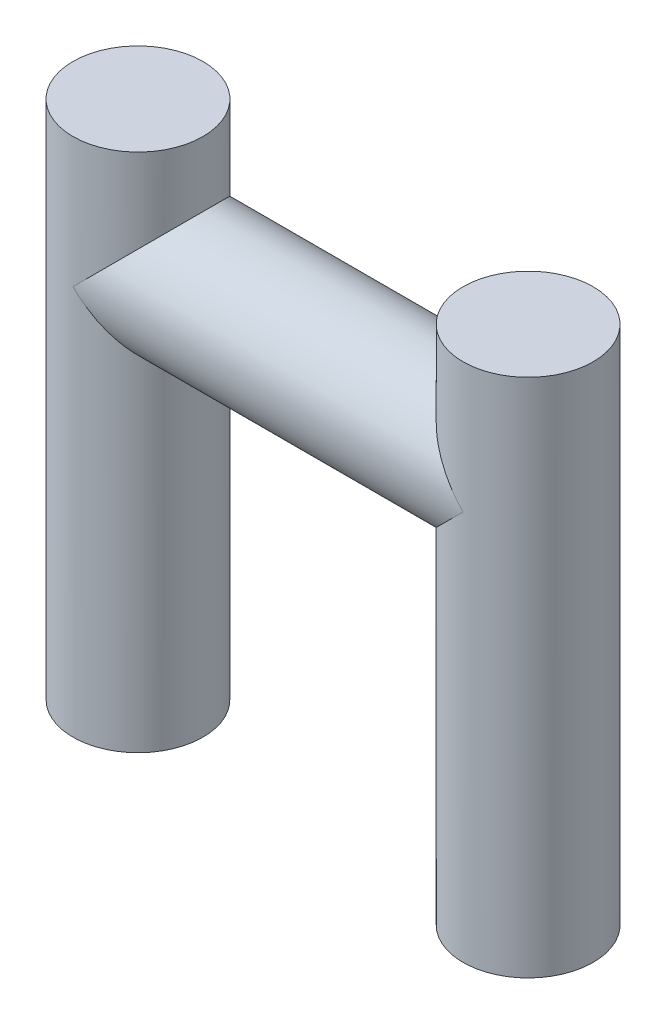
from build123d import *

# Parameters (mm, degrees)
SKETCH2_R           = 2.5
BOSS_EXTRUDE2_DEPTH = 10
SKETCH3_R           = 2.5
BOSS_EXTRUDE3_DEPTH = 7.5
BOSS_EXTRUDE4_START = 10
SKETCH4_R           = 2.5
BOSS_EXTRUDE4_DEPTH = 10


with BuildPart() as part:
    # Sketch2 → Boss-Extrude2 (new body)
    with BuildSketch(Plane(origin=(0, 0, 0), x_dir=(1, 0, 0), z_dir=(0, 1, 0))):
        with Locations(Location((0, 0, 0), (0, 0, 270))):
            Circle(SKETCH2_R)
    boss_extrude2 = extrude(amount=BOSS_EXTRUDE2_DEPTH)

    # Sketch3 → Boss-Extrude3 (add)
    with BuildSketch(Plane(origin=(0, 0, 0), x_dir=(0, 0, -1), z_dir=(1, 0, 0))):
        with Locations((0, 5)):
            Circle(SKETCH3_R)
    boss_extrude3 = extrude(amount=BOSS_EXTRUDE3_DEPTH)

    # Mirror5: Boss-Extrude2, Boss-Extrude3 across plane
    add(boss_extrude2.mirror(Plane(origin=(7.5, 5, 0), x_dir=(0, 0, 1), z_dir=(1, 0, 0))))
    add(boss_extrude3.mirror(Plane(origin=(7.5, 5, 0), x_dir=(0, 0, 1), z_dir=(1, 0, 0))))

    # Sketch4 → Boss-Extrude4 (add)
    with BuildSketch(Plane(origin=(0, 0, 0), x_dir=(-1, 0, 0), z_dir=(0, -1, 0)).offset(BOSS_EXTRUDE4_START)):
        with Locations(Location((0, 0, 0), (0, 0, 90))):
            Circle(SKETCH4_R)
        with Locations(Location((-15, 0, 0), (0, 0, 90))):
            Circle(SKETCH4_R)
    extrude(amount=-BOSS_EXTRUDE4_DEPTH)


solid = part.part
